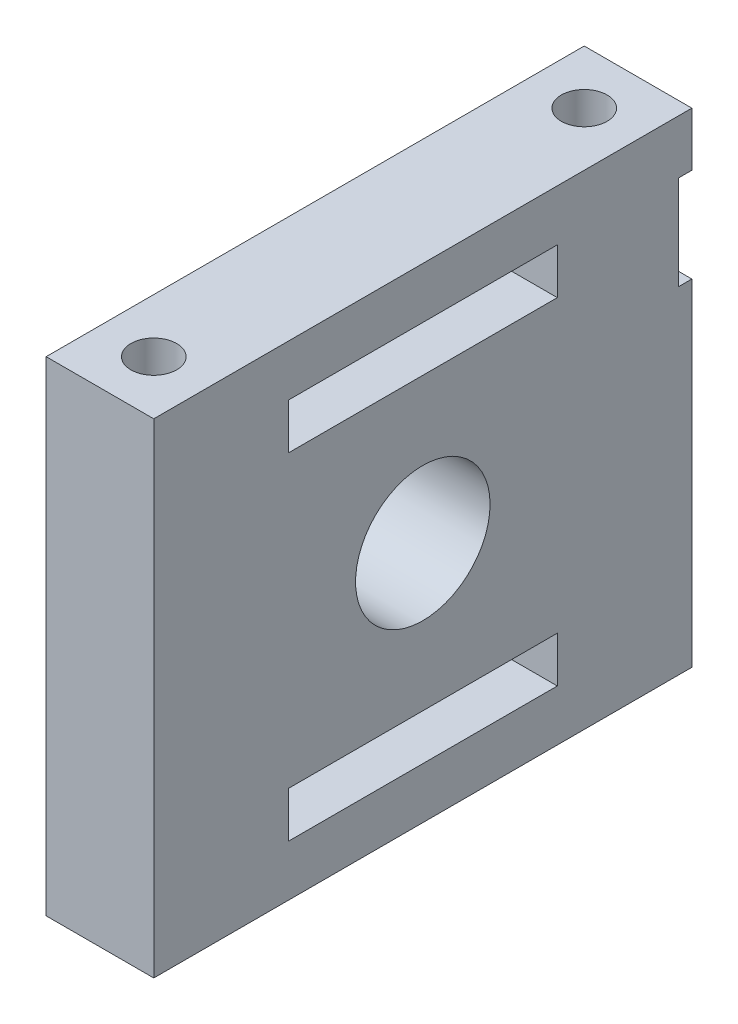
from build123d import *

# Parameters (mm, degrees)
SKETCH1_W           = 40
SKETCH1_H           = 36
BOSS_EXTRUDE1_DEPTH = 8
SKETCH2_R           = 5
CUT_EXTRUDE1_DEPTH  = 55.405882035
SKETCH3_W           = 20
SKETCH3_H           = 3.4
CUT_EXTRUDE2_DEPTH  = 55.405882035
SKETCH6_R           = 1.7
CUT_EXTRUDE3_DEPTH  = 55.405882035
SKETCH7_W           = 1
SKETCH7_H           = 7
CUT_EXTRUDE4_DEPTH  = 55.405882035


with BuildPart() as part:
    # Sketch1 → Boss-Extrude1 (new body)
    with BuildSketch(Plane(origin=(0, 0, 0), x_dir=(0, 0, -1), z_dir=(1, 0, 0))):
        with Locations((20, -18)):
            Rectangle(SKETCH1_W, SKETCH1_H)
    extrude(amount=BOSS_EXTRUDE1_DEPTH)

    # Sketch2 → Cut-Extrude1 (cut, through all)
    with BuildSketch(Plane(origin=(8, 0, 0), x_dir=(0, 0, -1), z_dir=(1, 0, 0))):
        with Locations((20, -18)):
            Circle(SKETCH2_R)
    extrude(amount=-CUT_EXTRUDE1_DEPTH, mode=Mode.SUBTRACT)

    # Sketch3 → Cut-Extrude2 (cut, through all)
    with BuildSketch(Plane(origin=(8, 0, 0), x_dir=(0, 0, -1), z_dir=(1, 0, 0))):
        with Locations((20, -5.5)):
            Rectangle(SKETCH3_W, SKETCH3_H)
        with Locations((20, -30.5)):
            Rectangle(SKETCH3_W, SKETCH3_H)
    extrude(amount=-CUT_EXTRUDE2_DEPTH, mode=Mode.SUBTRACT)

    # Sketch6 → Cut-Extrude3 (cut, through all)
    with BuildSketch(Plane(origin=(0, 0, 0), x_dir=(1, 0, 0), z_dir=(0, 1, 0))):
        with Locations(Location((4, 4, 0), (0, 0, 270))):
            Circle(SKETCH6_R)
        with Locations(Location((4, 36, 0), (0, 0, 270))):
            Circle(SKETCH6_R)
    extrude(amount=-CUT_EXTRUDE3_DEPTH, mode=Mode.SUBTRACT)

    # Sketch7 → Cut-Extrude4 (cut, through all)
    with BuildSketch(Plane(origin=(8, 0, 0), x_dir=(0, 0, -1), z_dir=(1, 0, 0))):
        with Locations((39.5, -7.5)):
            Rectangle(SKETCH7_W, SKETCH7_H)
    extrude(amount=-CUT_EXTRUDE4_DEPTH, mode=Mode.SUBTRACT)


solid = part.part
